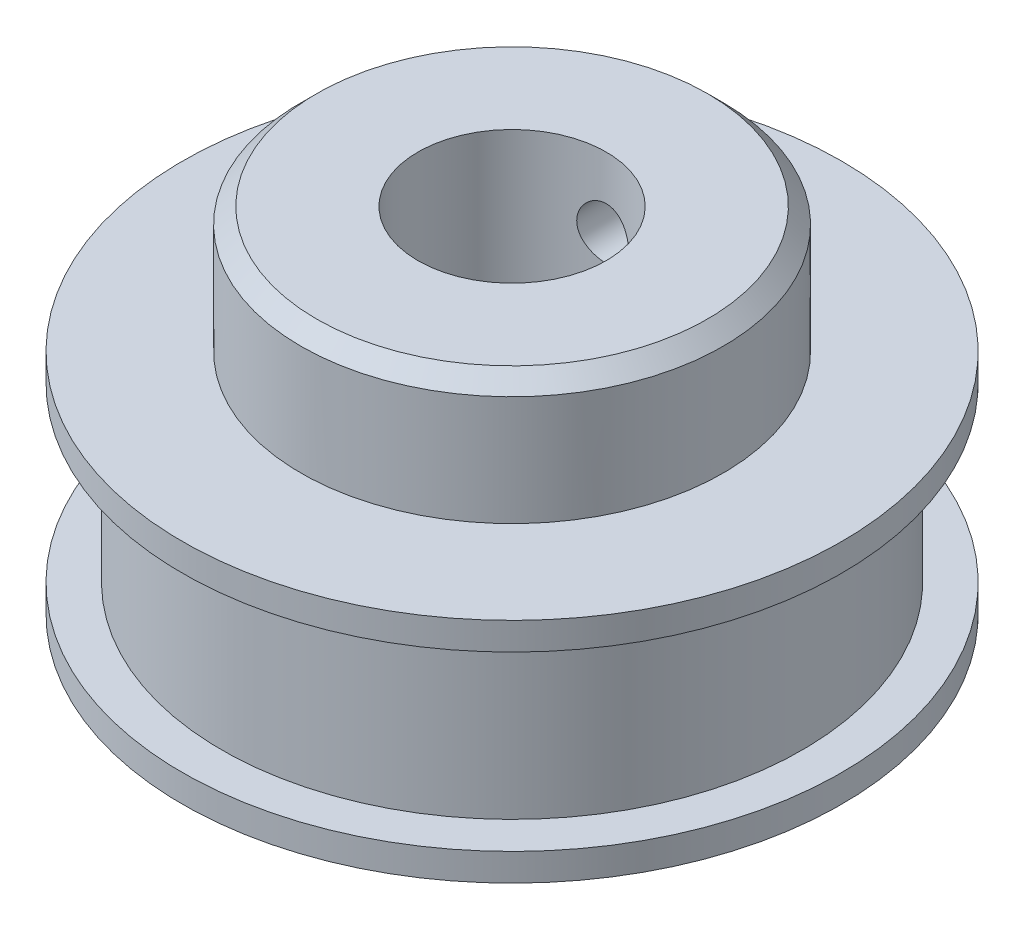
from build123d import *

# Parameters (mm, degrees)
SMUSSO1_SIZE             = 1
SCHIZZO2_R               = 6
TAGLIO_ESTRUSIONE1_DEPTH = 38.259227045
SCHIZZO3_R               = 1.65
TAGLIO_ESTRUSIONE2_DEPTH = 32.75787304


with BuildPart() as part:
    # Schizzo1 → Rivoluzione1 (revolve)
    with BuildSketch(Plane.XY, mode=Mode.PRIVATE) as rivoluzione1_sk:
        Polygon((0, 11.25), (13.45, 11.25), (13.45, 3.25), (21, 3.25), (21, 1.5), (18.5, 1.5), (18.5, -9.5), (21, -9.5), (21, -11.25), (0, -11.25), align=None)
    revolve(rivoluzione1_sk.sketch.rotate(Axis((0, -12.375, 0), (0, 1, 0)), 90), axis=Axis((0, -12.375, 0), (0, 1, 0)))

    # Smusso1
    smusso1_edges = [part.edges().sort_by_distance(p)[0] for p in [
        (0, 11.25, 13.45),
    ]]
    chamfer(smusso1_edges, length=SMUSSO1_SIZE)

    # Schizzo2 → Taglio-Estrusione1 (cut, through all)
    with BuildSketch(Plane(origin=(0, 11.25, 0), x_dir=(1, 0, 0), z_dir=(0, 1, 0))):
        with Locations(Location((0, 0, 0), (0, 0, 270))):
            Circle(SCHIZZO2_R)
    extrude(amount=-TAGLIO_ESTRUSIONE1_DEPTH, mode=Mode.SUBTRACT)

    # Schizzo3 → Taglio-Estrusione2 (cut, through all)
    with BuildSketch(Plane.XY):
        with Locations((0, 6.75)):
            Circle(SCHIZZO3_R)
    extrude(amount=-TAGLIO_ESTRUSIONE2_DEPTH, mode=Mode.SUBTRACT)


solid = part.part
